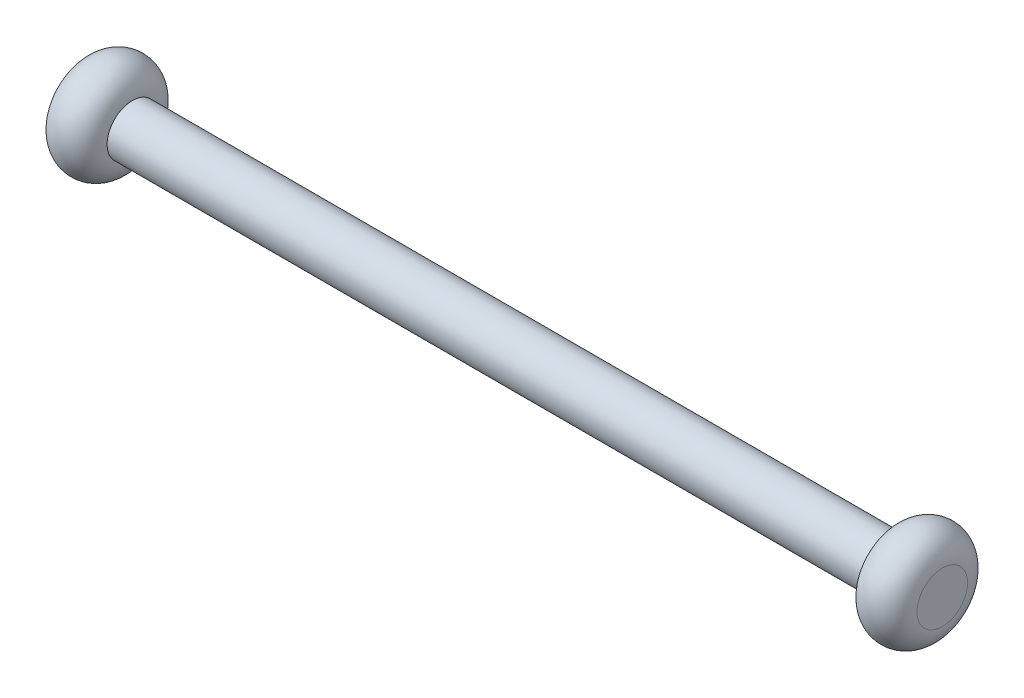
from build123d import *


with BuildPart() as part:
    # Sketch2 → Revolve1 (revolve)
    with BuildSketch(Plane.XY, mode=Mode.PRIVATE) as revolve1_sk:
        with BuildLine():
            Line((-85, 0), (85, 0))
            Line((85, 0), (85, 5))
            ThreePointArc((85, 5), (80, 10), (75, 5))
            Line((75, 5), (-75, 5))
            ThreePointArc((-75, 5), (-80, 10), (-85, 5))
            Line((-85, 5), (-85, 0))
        make_face()
    revolve(revolve1_sk.sketch.rotate(Axis((-85, 0, 0), (1, 0, 0)), 90), axis=Axis((-85, 0, 0), (1, 0, 0)))


solid = part.part
